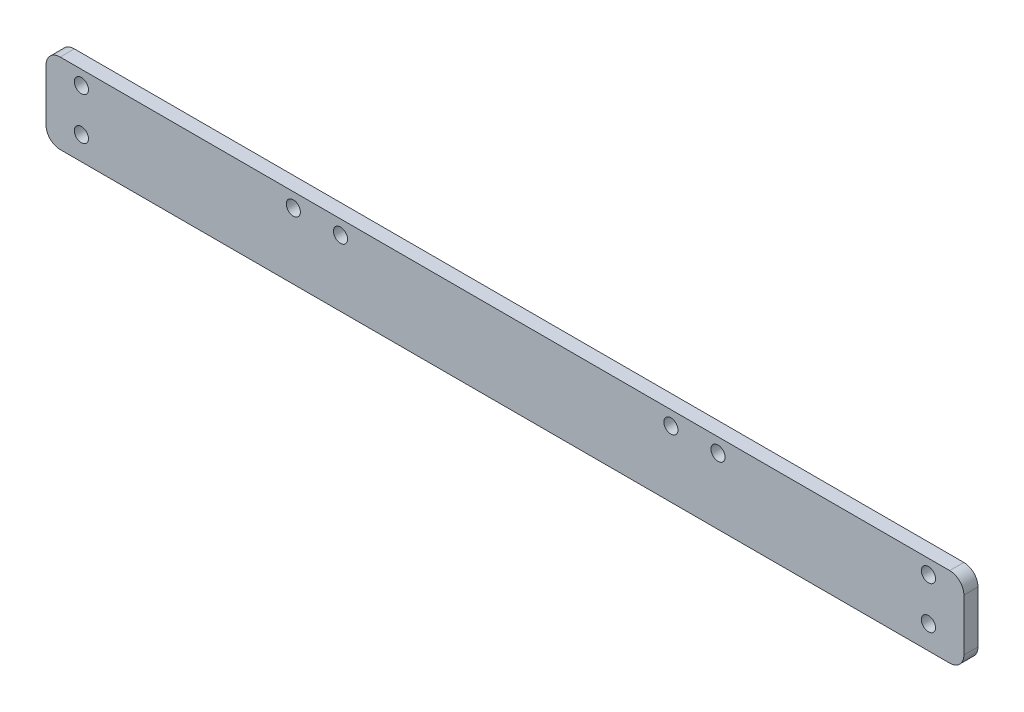
from build123d import *

# Parameters (mm, degrees)
SKETCH_1_W          = 194.6
SKETCH_1_H          = 17
EXTRUDE_1_DEPTH     = 3
FILLET_1_R          = 3
SKETCH_2_R          = 1.5
CUT_EXTRUDE_1_DEPTH = 3
SKETCH_3_R          = 1.5
CUT_EXTRUDE_2_DEPTH = 3
SKETCH_5_R          = 1.5
CUT_EXTRUDE_3_DEPTH = 3


with BuildPart() as part:
    # 草图1 → 凸台-拉伸1 (new body)
    with BuildSketch(Plane.XY):
        Rectangle(SKETCH_1_W, SKETCH_1_H)
    extrude(amount=EXTRUDE_1_DEPTH)

    # 圆角1
    fillet_1_edges = [part.edges().sort_by_distance(p)[0] for p in [
        (97.3, -8.5, 1.5),
        (-97.3, -8.5, 1.5),
        (-97.3, 8.5, 1.5),
        (97.3, 8.5, 1.5),
    ]]
    fillet(fillet_1_edges, radius=FILLET_1_R)

    # 草图2 → 切除-拉伸1 (cut)
    with BuildSketch(Plane.XY.offset(3)):
        with Locations((89.800213401, 5.5)):
            Circle(SKETCH_2_R)
        with Locations((89.800213401, -3.5)):
            Circle(SKETCH_2_R)
        with Locations((-89.8, -3.5)):
            Circle(SKETCH_2_R)
        with Locations((-89.8, 5.5)):
            Circle(SKETCH_2_R)
    extrude(amount=-CUT_EXTRUDE_1_DEPTH, mode=Mode.SUBTRACT)

    # 草图3 → 切除-拉伸2 (cut)
    with BuildSketch(Plane(origin=(0, 0, 0), x_dir=(-1, 0, 0), z_dir=(0, 0, -1))):
        with Locations((44.863842933, 5.5)):
            Circle(SKETCH_3_R)
        with Locations((34.863842933, 5.5)):
            Circle(SKETCH_3_R)
    extrude(amount=-CUT_EXTRUDE_2_DEPTH, mode=Mode.SUBTRACT)

    # 草图5 → 切除-拉伸3 (cut)
    with BuildSketch(Plane(origin=(0, 0, 0), x_dir=(-1, 0, 0), z_dir=(0, 0, -1))):
        with Locations((-45.188251481, 5.5)):
            Circle(SKETCH_5_R)
        with Locations((-35.188251481, 5.5)):
            Circle(SKETCH_5_R)
    extrude(amount=-CUT_EXTRUDE_3_DEPTH, mode=Mode.SUBTRACT)


solid = part.part
